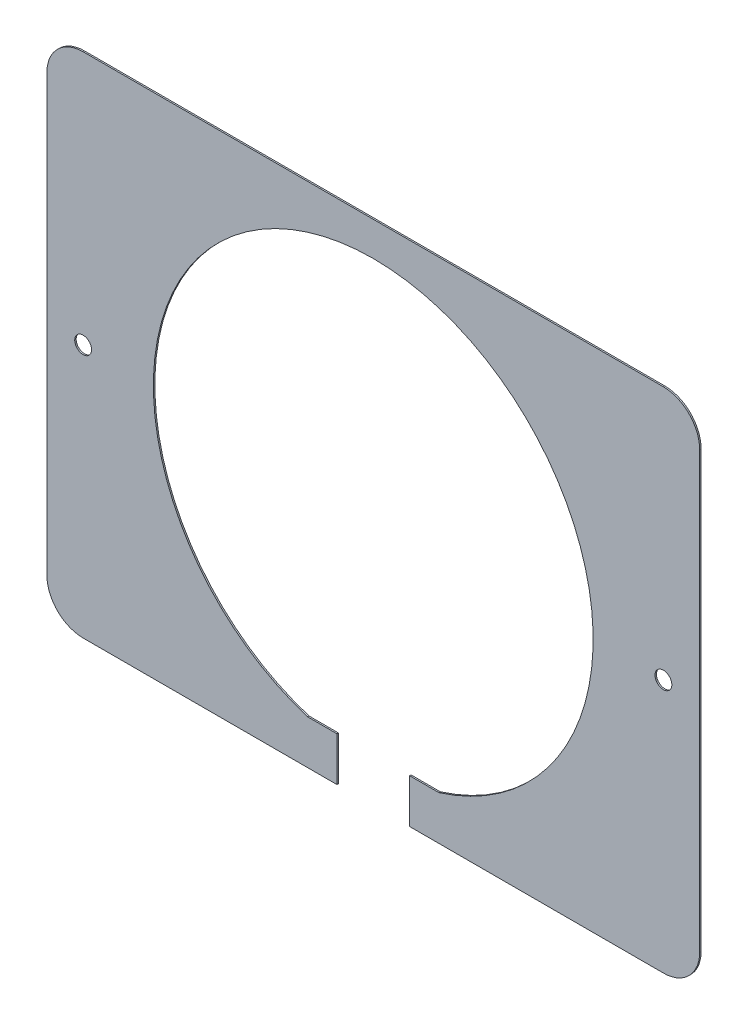
from build123d import *

# Parameters (mm, degrees)
SKETCH2_R           = 1.475
BOSS_EXTRUDE1_DEPTH = 0.254
FILLET1_R           = 6.35


with BuildPart() as part:
    # Sketch2 → Boss-Extrude1 (new body)
    # profile 1 of 3: a face of its own
    with BuildSketch(Plane.XY):
        with BuildLine():
            ThreePointArc((-6.35, -37.972720471), (-8.946176851, -37.446173633), (-11.5, -36.742346142))
            ThreePointArc((-11.5, -36.742346142), (-22.79802623, 31.024184115), (38.5, 0))
            ThreePointArc((38.5, 0), (31.024184115, -22.79802623), (11.5, -36.742346142))
            ThreePointArc((11.5, -36.742346142), (8.946176851, -37.446173633), (6.35, -37.972720471))
            Line((6.35, -37.972720471), (6.35, -44.45))
            Line((6.35, -44.45), (57.15, -44.45))
            Line((57.15, -44.45), (57.15, 44.45))
            Line((57.15, 44.45), (-57.15, 44.45))
            Line((-57.15, 44.45), (-57.15, -44.45))
            Line((-57.15, -44.45), (-6.35, -44.45))
            Line((-6.35, -44.45), (-6.35, -37.972720471))
        make_face()
        with Locations((-50.8, 0)):
            Circle(SKETCH2_R, mode=Mode.SUBTRACT)
        with Locations((50.8, 0)):
            Circle(SKETCH2_R, mode=Mode.SUBTRACT)
    # profile 2 of 3: a face of its own
    with BuildSketch(Plane.XY):
        with BuildLine():
            Line((11.5, -36.742346142), (6.35, -36.742346142))
            Line((6.35, -36.742346142), (6.35, -37.972720471))
            ThreePointArc((6.35, -37.972720471), (8.946176851, -37.446173633), (11.5, -36.742346142))
        make_face()
    # profile 3 of 3: a face of its own
    with BuildSketch(Plane.XY):
        with BuildLine():
            Line((-6.35, -36.742346142), (-11.5, -36.742346142))
            ThreePointArc((-11.5, -36.742346142), (-8.946176851, -37.446173633), (-6.35, -37.972720471))
            Line((-6.35, -37.972720471), (-6.35, -36.742346142))
        make_face()
    extrude(amount=BOSS_EXTRUDE1_DEPTH)

    # Fillet1
    fillet1_edges = [part.edges().sort_by_distance(p)[0] for p in [
        (-57.15, -44.45, 0.127),
        (-57.15, 44.45, 0.127),
        (57.15, 44.45, 0.127),
        (57.15, -44.45, 0.127),
    ]]
    fillet(fillet1_edges, radius=FILLET1_R)


solid = part.part
